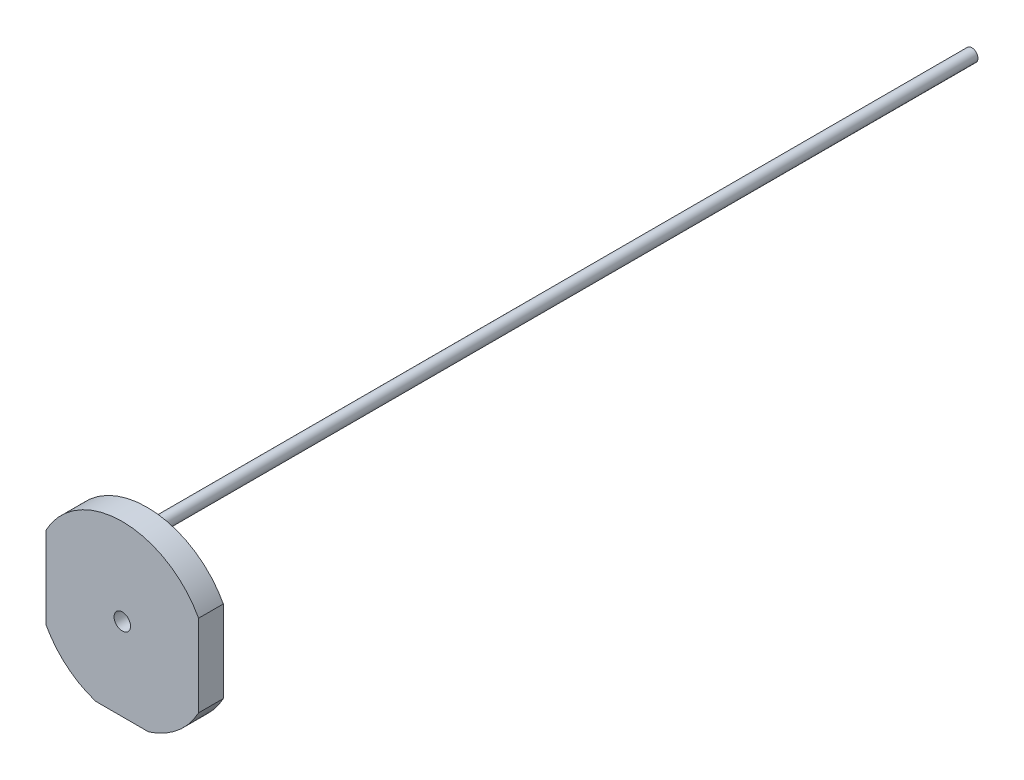
from build123d import *

# Parameters (mm, degrees)
SKETCH_1_R      = 2
SKETCH_1_R_2    = 1.5
EXTRUDE_1_DEPTH = 6
SKETCH_1_4_R    = 1.5
EXTRUDE_2_DEPTH = 206


with BuildPart() as part:
    # 草图1 → 凸台-拉伸1 (new body)
    with BuildSketch(Plane.XY):
        with BuildLine():
            Line((-18.5, 9.937303457), (-18.5, -9.937303457))
            ThreePointArc((-18.5, -9.937303457), (-13.429663608, -16.144476931), (-6.403124237, -20))
            Line((-6.403124237, -20), (6.403124237, -20))
            ThreePointArc((6.403124237, -20), (13.429663608, -16.144476931), (18.5, -9.937303457))
            Line((18.5, -9.937303457), (18.5, 9.937303457))
            ThreePointArc((18.5, 9.937303457), (0, 21), (-18.5, 9.937303457))
        make_face()
        Circle(SKETCH_1_R, mode=Mode.SUBTRACT)
        with Locations((0, 16)):
            Circle(SKETCH_1_R_2, mode=Mode.SUBTRACT)
    extrude(amount=-EXTRUDE_1_DEPTH)

    # 草图1<4> → 凸台-拉伸2 (add)
    with BuildSketch(Plane.XY):
        with Locations((0, 16)):
            Circle(SKETCH_1_4_R)
    extrude(amount=-EXTRUDE_2_DEPTH)


solid = part.part
